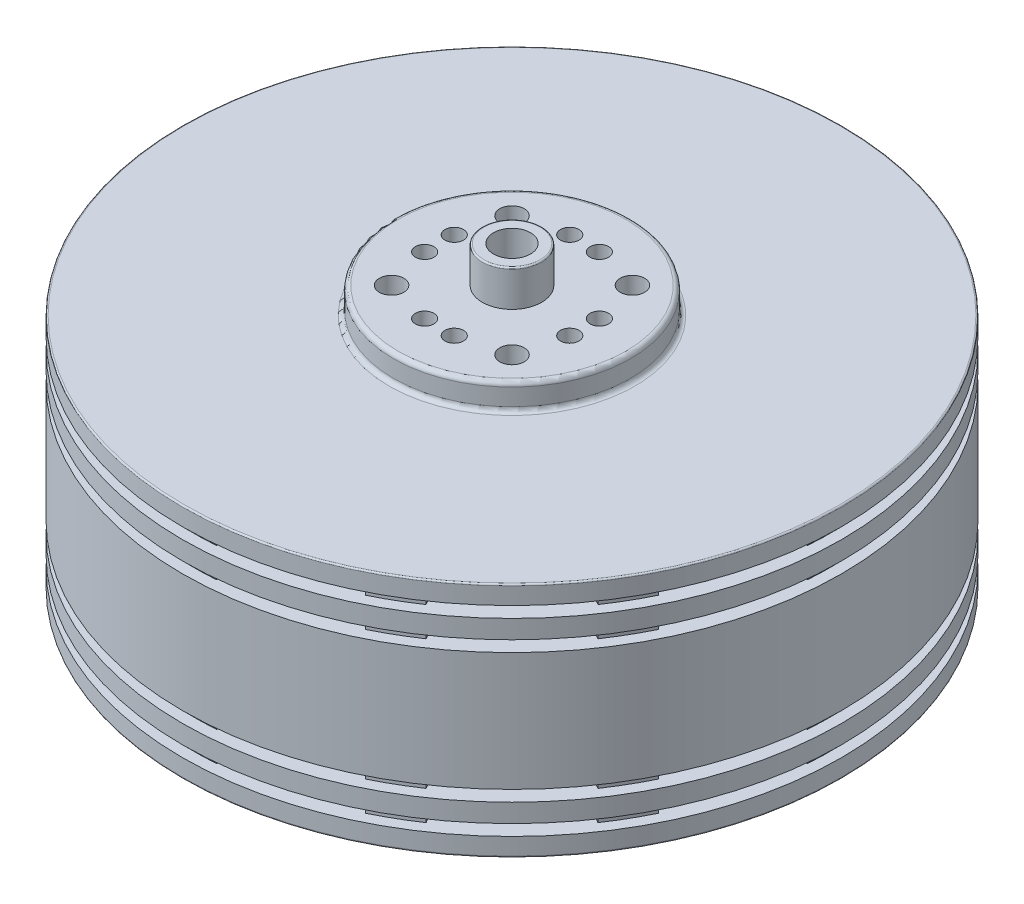
from build123d import *

# Parameters (mm, degrees)
SKETCH_1_R                  = 44.5
EXTRUDE_1_DEPTH             = 2.5
SKETCH_2_R                  = 44.5
EXTRUDE_2_DEPTH             = 2.5
SKETCH_3_R                  = 44.5
EXTRUDE_3_DEPTH             = 16
SKETCH_4_R                  = 44.5
EXTRUDE_4_DEPTH             = 2.5
SKETCH_5_R                  = 44.5
EXTRUDE_5_DEPTH             = 2.5
SKETCH_6_R                  = 16
EXTRUDE_6_DEPTH             = 3.5
SKETCH_7_R                  = 4
EXTRUDE_7_DEPTH             = 4.9
EXTRUDE_8_DEPTH             = 29.5
PATTERN_CIRCULAR_1_COUNT    = 12
FILLET_1_R                  = 0.6
FILLET_2_R                  = 0.2
FILLET_3_R                  = 0.2
SKETCH_9_R                  = 0.75
CUT_EXTRUDE_1_DEPTH         = 5
FILLET_4_R                  = 0.1
SKETCH_11_R                 = 25
EXTRUDE_9_DEPTH             = 4
FILLET_5_R                  = 0.5
SKETCH_12_R                 = 1
CUT_EXTRUDE_3_DEPTH         = 2
PATTERN_CIRCULAR_3_COUNT    = 4
CUT_EXTRUDE_4_DEPTH         = 2
PATTERN_CIRCULAR_4_COUNT    = 4
SKETCH_15_R                 = 10
CUT_EXTRUDE_5_DEPTH         = 2
SKETCH_16_R                 = 1
CUT_EXTRUDE_6_DEPTH         = 2
PATTERN_CIRCULAR_5_COUNT    = 4
HOLE_WIZARD_M3_1_AT_2_COUNT = 2
HOLE_WIZARD_M3_1_AT_2_PITCH = 4
PATTERN_CIRCULAR_6_COUNT    = 4
HOLE_WIZARD_M6_1_D          = 5
HOLE_WIZARD_M6_1_DEPTH      = 15
HOLE_WIZARD_M6_1_TIP        = 1.502151548


with BuildPart() as part:
    # 草图1 → 凸台-拉伸1 (new body)
    with BuildSketch(Plane(origin=(0, 0, 0), x_dir=(1, 0, 0), z_dir=(0, 1, 0))):
        with Locations(Location((0, 0, 0), (0, 0, 270))):
            Circle(SKETCH_1_R)
    extrude(amount=EXTRUDE_1_DEPTH)



with BuildPart() as body_2:
    # 草图2 → 凸台-拉伸2 (new body)
    with BuildSketch(Plane(origin=(0, 4, 0), x_dir=(1, 0, 0), z_dir=(0, 1, 0))):
        with Locations(Location((0, 0, 0), (0, 0, 270))):
            Circle(SKETCH_2_R)
    extrude(amount=EXTRUDE_2_DEPTH)


with BuildPart() as body_3:
    # 草图3 → 凸台-拉伸3 (new body)
    with BuildSketch(Plane(origin=(0, 8, 0), x_dir=(1, 0, 0), z_dir=(0, 1, 0))):
        with Locations(Location((0, 0, 0), (0, 0, 270))):
            Circle(SKETCH_3_R)
    extrude(amount=EXTRUDE_3_DEPTH)


with BuildPart() as body_4:
    # 草图4 → 凸台-拉伸4 (new body)
    with BuildSketch(Plane(origin=(0, 25.5, 0), x_dir=(1, 0, 0), z_dir=(0, 1, 0))):
        with Locations(Location((0, 0, 0), (0, 0, 270))):
            Circle(SKETCH_4_R)
    extrude(amount=EXTRUDE_4_DEPTH)


with BuildPart() as body_5:
    # 草图5 → 凸台-拉伸5 (new body)
    with BuildSketch(Plane(origin=(0, 29.5, 0), x_dir=(1, 0, 0), z_dir=(0, 1, 0))):
        with Locations(Location((0, 0, 0), (0, 0, 270))):
            Circle(SKETCH_5_R)
    extrude(amount=EXTRUDE_5_DEPTH)

    # 草图6 → 凸台-拉伸6 (add)
    with BuildSketch(Plane(origin=(0, 32, 0), x_dir=(1, 0, 0), z_dir=(0, 1, 0))):
        with Locations(Location((0, 0, 0), (0, 0, 270))):
            Circle(SKETCH_6_R)
    extrude(amount=EXTRUDE_6_DEPTH)

    # 草图7 → 凸台-拉伸7 (add)
    with BuildSketch(Plane(origin=(0, 35.5, 0), x_dir=(1, 0, 0), z_dir=(0, 1, 0))):
        with Locations(Location((0, 0, 0), (0, 0, 270))):
            Circle(SKETCH_7_R)
    extrude(amount=EXTRUDE_7_DEPTH)


with BuildPart() as part_1:
    add(part.part)

    add(body_2.part)  # 凸台-拉伸8 merges body 2

    add(body_3.part)  # 凸台-拉伸8 merges body 3

    add(body_4.part)  # 凸台-拉伸8 merges body 4

    add(body_5.part)  # 凸台-拉伸8 merges body 5
    # 草图8 → 凸台-拉伸8 (add)
    with BuildSketch(Plane(origin=(0, 32, 0), x_dir=(1, 0, 0), z_dir=(0, 1, 0))):
        with BuildLine():
            Line((3, 39.385911187), (3, 42.895221179))
            ThreePointArc((3, 42.895221179), (0, 43), (-3, 42.895221179))
            Line((-3, 42.895221179), (-3, 39.385911187))
            ThreePointArc((-3, 39.385911187), (0, 39.5), (3, 39.385911187))
        make_face()
    extrude_8 = extrude(amount=-EXTRUDE_8_DEPTH)

    # 阵列(圆周)1: 凸台-拉伸8 ×12 about axis
    pattern_circular_1_axis = Axis((0, 0, 0), (0, 1, 0))
    for i in range(1, PATTERN_CIRCULAR_1_COUNT):
        add(extrude_8.rotate(pattern_circular_1_axis, i * 360 / PATTERN_CIRCULAR_1_COUNT))

    # 圆角1
    fillet_1_edges = [part_1.edges().sort_by_distance(p)[0] for p in [
        (0, 32, -16),
        (0, 35.5, -16),
    ]]
    fillet(fillet_1_edges, radius=FILLET_1_R)

    # 圆角2
    fillet_2_edges = [part_1.edges().sort_by_distance(p)[0] for p in [
        (0, 40.4, -4),
    ]]
    fillet(fillet_2_edges, radius=FILLET_2_R)

    # 圆角3
    fillet_3_edges = [part_1.edges().sort_by_distance(p)[0] for p in [
        (0, 0, -44.5),
        (0, 32, -44.5),
    ]]
    fillet(fillet_3_edges, radius=FILLET_3_R)

    # 草图9 → 切除-拉伸1 (cut)
    with BuildSketch(Plane(origin=(0, 35.5, 0), x_dir=(1, 0, 0), z_dir=(0, 1, 0))):
        with Locations(Location((-8.131727984, 8.131727984, 0), (0, 0, 270))):
            Circle(SKETCH_9_R)
        with Locations(Location((8.131727984, 8.131727984, 0), (0, 0, 270))):
            Circle(SKETCH_9_R)
        with Locations(Location((8.131727984, -8.131727984, 0), (0, 0, 270))):
            Circle(SKETCH_9_R)
        with Locations(Location((-8.131727984, -8.131727984, 0), (0, 0, 270))):
            Circle(SKETCH_9_R)
    extrude(amount=-CUT_EXTRUDE_1_DEPTH, mode=Mode.SUBTRACT)

    # 圆角4
    fillet_4_edges = [part_1.edges().sort_by_distance(p)[0] for p in [
        (-8.131727984, 35.5, 7.381727984),
        (8.131727984, 35.5, 7.381727984),
        (8.131727984, 35.5, -8.881727984),
        (-8.131727984, 35.5, -8.881727984),
    ]]
    fillet(fillet_4_edges, radius=FILLET_4_R)

    # 草图11 → 凸台-拉伸9 (add)
    with BuildSketch(Plane.XZ):
        with Locations(Location((0, 0, 0), (0, 0, 90))):
            Circle(SKETCH_11_R)
    extrude(amount=EXTRUDE_9_DEPTH)

    # 圆角5
    fillet_5_edges = [part_1.edges().sort_by_distance(p)[0] for p in [
        (0, 0, -25),
        (0, -4, -25),
    ]]
    fillet(fillet_5_edges, radius=FILLET_5_R)

    # 草图12 → 切除-拉伸3 (cut)
    with BuildSketch(Plane.XZ.offset(4)):
        with Locations(Location((14.142135624, 14.142135624, 0), (0, 0, 270))):
            Circle(SKETCH_12_R)
    extrude(amount=-CUT_EXTRUDE_3_DEPTH, mode=Mode.SUBTRACT)

    # 草图13 → M4 螺纹孔1 (revolve, cut)
    with BuildSketch(Plane(origin=(14.142135624, -4, 14.142135624), x_dir=(0, 0, -1), z_dir=(1, 0, 0))):
        Polygon((0, 0), (0, 10.991420021), (1.65, 10), (1.65, 0), align=None)
    hole_wizard_m4_1 = revolve(axis=Axis((14.142135624, -10.35, 14.142135624), (0, 1, 0)), mode=Mode.SUBTRACT)

    # 阵列(圆周)3: M4 螺纹孔1 ×4 about axis
    pattern_circular_3_axis = Axis((0, 0, 0), (0, 1, 0))
    for i in range(1, PATTERN_CIRCULAR_3_COUNT):
        add(hole_wizard_m4_1.rotate(pattern_circular_3_axis, i * 360 / PATTERN_CIRCULAR_3_COUNT), mode=Mode.SUBTRACT)

    # 草图14 → 切除-拉伸4 (cut)
    with BuildSketch(Plane.XZ.offset(4)):
        with BuildLine():
            ThreePointArc((3.670352779, 10.898555431), (4.765169434, 10.846749958), (5.722888563, 11.379742813))
            Line((5.722888563, 11.379742813), (10.983931472, 16.640785721))
            ThreePointArc((10.983931472, 16.640785721), (11.818318793, 19.275713113), (10.143952496, 21.474699713))
            ThreePointArc((10.143952496, 21.474699713), (0, 23.75), (-10.143952496, 21.474699713))
            ThreePointArc((-10.143952496, 21.474699713), (-11.818318793, 19.275713113), (-10.983931472, 16.640785721))
            Line((-10.983931472, 16.640785721), (-5.722888563, 11.379742813))
            ThreePointArc((-5.722888563, 11.379742813), (-4.765169434, 10.846749958), (-3.670352779, 10.898555431))
            ThreePointArc((-3.670352779, 10.898555431), (0, 11.5), (3.670352779, 10.898555431))
        make_face()
    cut_extrude_4 = extrude(amount=-CUT_EXTRUDE_4_DEPTH, mode=Mode.SUBTRACT)

    # 阵列(圆周)4: 切除-拉伸4 ×4 about axis
    pattern_circular_4_axis = Axis((0, 0, 0), (0, 1, 0))
    for i in range(1, PATTERN_CIRCULAR_4_COUNT):
        add(cut_extrude_4.rotate(pattern_circular_4_axis, i * 360 / PATTERN_CIRCULAR_4_COUNT), mode=Mode.SUBTRACT)

    # 草图15 → 切除-拉伸5 (cut)
    with BuildSketch(Plane.XZ.offset(4)):
        with Locations(Location((0, 0, 0), (0, 0, 270))):
            Circle(SKETCH_15_R)
    extrude(amount=-CUT_EXTRUDE_5_DEPTH, mode=Mode.SUBTRACT)

    # 草图16 → 切除-拉伸6 (cut)
    with BuildSketch(Plane(origin=(0, 35.5, 0), x_dir=(1, 0, 0), z_dir=(0, 1, 0))):
        with Locations(Location((2, 9.797958971, 0), (0, 0, 270))):
            Circle(SKETCH_16_R)
        with Locations(Location((-2, 9.797958971, 0), (0, 0, 90))):
            Circle(SKETCH_16_R)
    extrude(amount=-CUT_EXTRUDE_6_DEPTH, mode=Mode.SUBTRACT)

    # 草图17 → M4 螺纹孔2 (revolve, cut)
    with BuildSketch(Plane(origin=(8.131727984, 35.5, -8.131727984), x_dir=(0, 0, 1), z_dir=(1, 0, 0))):
        Polygon((0, 0), (0, 11.091420021), (1.65, 10.1), (1.65, 0), align=None)
    hole_wizard_m4_2 = revolve(axis=Axis((8.131727984, 41.85, -8.131727984), (0, -1, 0)), mode=Mode.SUBTRACT)

    # 阵列(圆周)5: M4 螺纹孔2 ×4 about axis
    pattern_circular_5_axis = Axis((0, 0, 0), (0, 1, 0))
    for i in range(1, PATTERN_CIRCULAR_5_COUNT):
        add(hole_wizard_m4_2.rotate(pattern_circular_5_axis, i * 360 / PATTERN_CIRCULAR_5_COUNT), mode=Mode.SUBTRACT)

    # 草图18 → M3 螺纹孔1 (revolve, cut)
    with BuildSketch(Plane(origin=(2, 35.5, -9.797958971), x_dir=(0, 0, 1), z_dir=(1, 0, 0))):
        Polygon((0, 0), (0, 8.251075774), (1.25, 7.5), (1.25, 0), align=None)
    hole_wizard_m3_1 = revolve(axis=Axis((2, 41.85, -9.797958971), (0, -1, 0)), mode=Mode.SUBTRACT)

    # M3 螺纹孔1 at 2: M3 螺纹孔1 ×2
    with Locations(*[(-i * HOLE_WIZARD_M3_1_AT_2_PITCH, 0, 0) for i in range(1, HOLE_WIZARD_M3_1_AT_2_COUNT)]):
        add(hole_wizard_m3_1, mode=Mode.SUBTRACT)

    # 阵列(圆周)6: M3 螺纹孔1 ×4 about axis
    pattern_circular_6_axis = Axis((0, 0, 0), (0, 1, 0))
    for i in range(1, PATTERN_CIRCULAR_6_COUNT):
        add(hole_wizard_m3_1.rotate(pattern_circular_6_axis, i * 360 / PATTERN_CIRCULAR_6_COUNT), mode=Mode.SUBTRACT)

    # 阵列(圆周)6 copy 1 sketch → 阵列(圆周)6 copy 1 (revolve, cut)
    with BuildSketch(Plane(origin=(-9.797958971, 35.5, 2), x_dir=(1, 0, 0), z_dir=(0, 0, -1))):
        Polygon((0, 0), (0, 8.251075774), (1.25, 7.5), (1.25, 0), align=None)
    revolve(axis=Axis((-9.797958971, 41.85, 2), (0, -1, 0)), mode=Mode.SUBTRACT)

    # 阵列(圆周)6 copy 2 sketch → 阵列(圆周)6 copy 2 (revolve, cut)
    with BuildSketch(Plane(origin=(2, 35.5, 9.797958971), x_dir=(0, 0, -1), z_dir=(-1, 0, 0))):
        Polygon((0, 0), (0, 8.251075774), (1.25, 7.5), (1.25, 0), align=None)
    revolve(axis=Axis((2, 41.85, 9.797958971), (0, -1, 0)), mode=Mode.SUBTRACT)

    # 阵列(圆周)6 copy 3 sketch → 阵列(圆周)6 copy 3 (revolve, cut)
    with BuildSketch(Plane(origin=(9.797958971, 35.5, -2), x_dir=(-1, 0, 0), z_dir=(0, 0, 1))):
        Polygon((0, 0), (0, 8.251075774), (1.25, 7.5), (1.25, 0), align=None)
    revolve(axis=Axis((9.797958971, 41.85, -2), (0, -1, 0)), mode=Mode.SUBTRACT)

    # M6 螺纹孔1
    with Locations(Plane.ZX.offset(40.4)):
        with Locations((0, 0)):
            Hole(HOLE_WIZARD_M6_1_D / 2, depth=HOLE_WIZARD_M6_1_DEPTH)
            with Locations((0, 0, -(HOLE_WIZARD_M6_1_DEPTH + HOLE_WIZARD_M6_1_TIP / 2))):  # 118° drill point
                Cone(0, HOLE_WIZARD_M6_1_D / 2, HOLE_WIZARD_M6_1_TIP, mode=Mode.SUBTRACT)


solid = part_1.part
